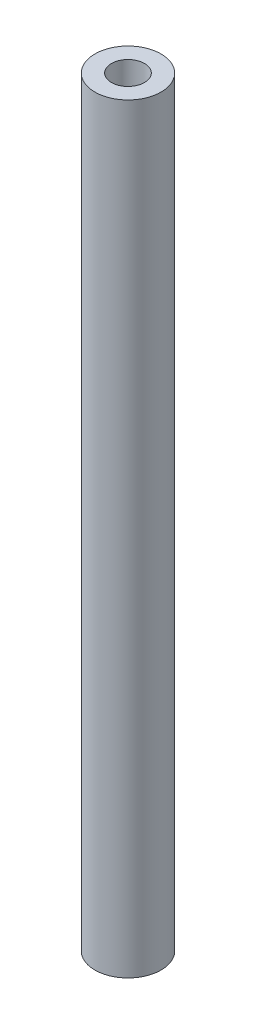
from build123d import *

# Parameters (mm, degrees)
SKETCH1_R           = 5
SKETCH1_R_2         = 2.5
BOSS_EXTRUDE1_DEPTH = 115


with BuildPart() as part:
    # Sketch1 → Boss-Extrude1 (new body)
    with BuildSketch(Plane(origin=(0, 0, 0), x_dir=(1, 0, 0), z_dir=(0, 1, 0))):
        with Locations(Location((-0.95128767, -2.46214322, 0), (0, 0, 270))):
            Circle(SKETCH1_R)
        with Locations(Location((-0.95128767, -2.46214322, 0), (0, 0, 270))):
            Circle(SKETCH1_R_2, mode=Mode.SUBTRACT)
    extrude(amount=BOSS_EXTRUDE1_DEPTH)


solid = part.part
